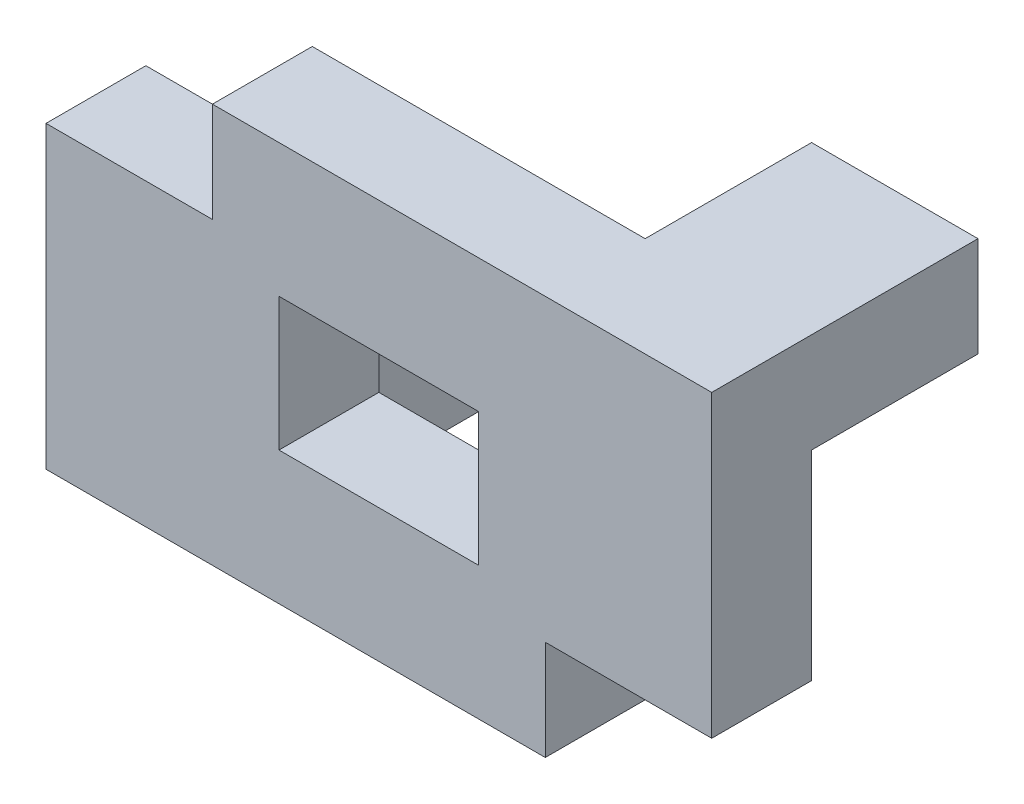
from build123d import *

# Parameters (mm, degrees)
SKETCH2_W           = 100
SKETCH2_H           = 60
BOSS_EXTRUDE1_DEPTH = 15
SKETCH3_W           = 25
SKETCH3_H           = 15
BOSS_EXTRUDE2_DEPTH = 25
SKETCH4_W           = 25
SKETCH4_H           = 15
CUT_EXTRUDE1_DEPTH  = 25
SKETCH5_W           = 30
SKETCH5_H           = 20
CUT_EXTRUDE2_DEPTH  = 25


with BuildPart() as part:
    # Sketch2 → Boss-Extrude1 (new body)
    with BuildSketch(Plane.XY):
        Rectangle(SKETCH2_W, SKETCH2_H)
    extrude(amount=BOSS_EXTRUDE1_DEPTH)

    # Sketch3 → Boss-Extrude2 (add)
    with BuildSketch(Plane(origin=(0, 0, 0), x_dir=(-1, 0, 0), z_dir=(0, 0, -1))):
        with Locations((-37.5, 22.5)):
            Rectangle(SKETCH3_W, SKETCH3_H)
        with Locations((37.5, -22.5)):
            Rectangle(SKETCH3_W, SKETCH3_H)
    extrude(amount=BOSS_EXTRUDE2_DEPTH)

    # Sketch4 → Cut-Extrude1 (cut)
    with BuildSketch(Plane(origin=(0, 0, 0), x_dir=(-1, 0, 0), z_dir=(0, 0, -1))):
        with Locations((-37.5, -22.5)):
            Rectangle(SKETCH4_W, SKETCH4_H)
        with Locations((37.5, 22.5)):
            Rectangle(SKETCH4_W, SKETCH4_H)
    extrude(amount=-CUT_EXTRUDE1_DEPTH, mode=Mode.SUBTRACT)

    # Sketch5 → Cut-Extrude2 (cut)
    with BuildSketch(Plane(origin=(0, 0, 0), x_dir=(-1, 0, 0), z_dir=(0, 0, -1))):
        Rectangle(SKETCH5_W, SKETCH5_H)
    extrude(amount=-CUT_EXTRUDE2_DEPTH, mode=Mode.SUBTRACT)


solid = part.part
